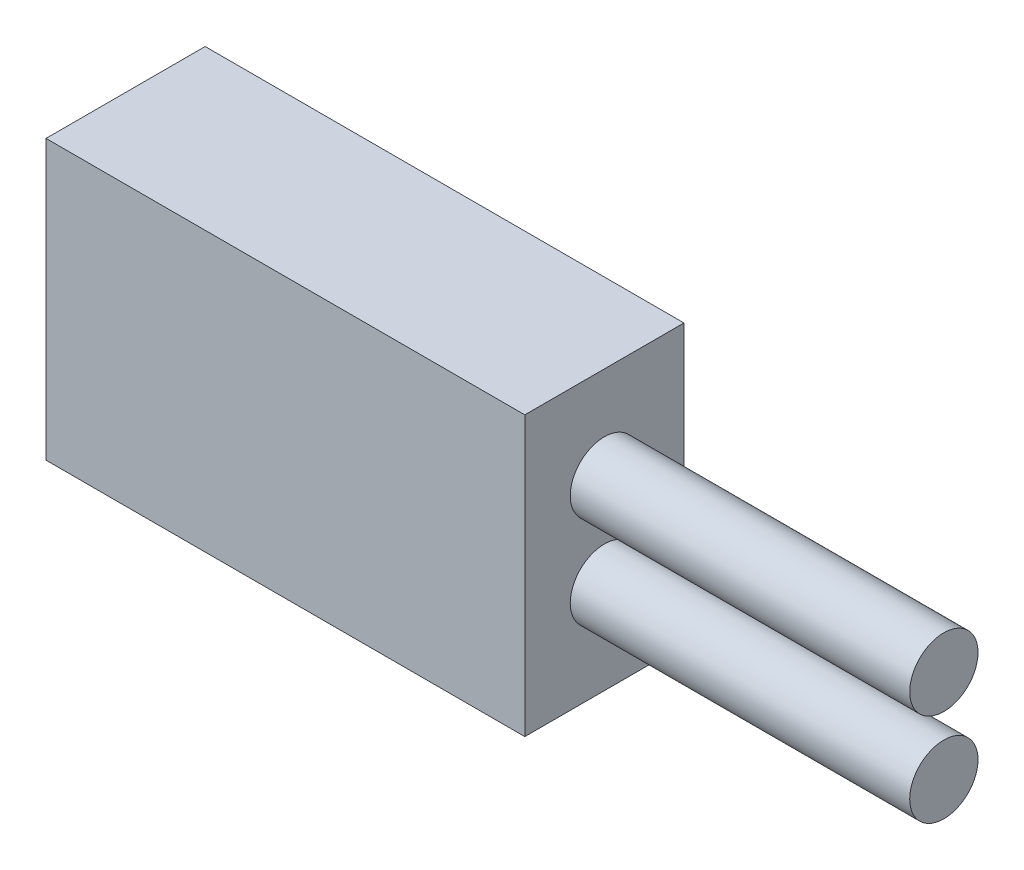
from build123d import *

# Parameters (mm, degrees)
SKETCH1_W           = 70.1
SKETCH1_H           = 40.8
BOSS_EXTRUDE1_DEPTH = 23.3
SKETCH2_R           = 5
BOSS_EXTRUDE2_DEPTH = 49.7


with BuildPart() as part:
    # Sketch1 → Boss-Extrude1 (new body)
    with BuildSketch(Plane.XY):
        with Locations((35.05, 20.4)):
            Rectangle(SKETCH1_W, SKETCH1_H)
    extrude(amount=BOSS_EXTRUDE1_DEPTH)

    # Sketch2 → Boss-Extrude2 (add)
    with BuildSketch(Plane(origin=(70.1, 0, 0), x_dir=(0, 0, -1), z_dir=(1, 0, 0))):
        with Locations((-11.65, 27.2)):
            Circle(SKETCH2_R)
        with Locations(Location((-11.65, 13.6, 0), (0, 0, 180))):
            Circle(SKETCH2_R)
    extrude(amount=BOSS_EXTRUDE2_DEPTH)


solid = part.part
